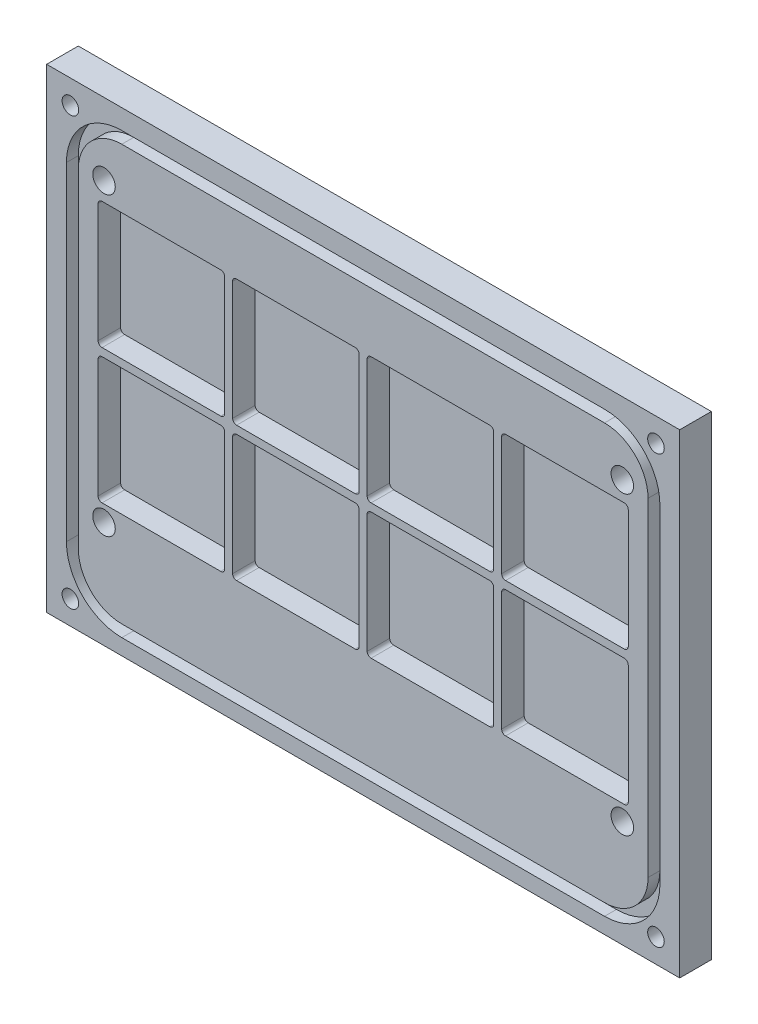
from build123d import *

# Parameters (mm, degrees)
ESQUISSE1_W                                   = 160
ESQUISSE1_H                                   = 120
BOSS_EXTRU_1_DEPTH                            = 8
ESQUISSE2_W                                   = 32
ESQUISSE2_H                                   = 32
ENL_V_MAT_EXTRU_1_DEPTH                       = 5.7
ENL_V_MAT_EXTRU_2_DEPTH                       = 3
TROU_POUR_TARAUDAGE_POUR_TROU_TARAUD_M5_D     = 4.2
TROU_POUR_TARAUDAGE_POUR_TROU_TARAUD_M5_DEPTH = 8
TROU_POUR_TARAUDAGE_POUR_TROU_TARAUD_M5_TIP   = 1.2618073
CONG_1_R                                      = 1
ESQUISSE7_R                                   = 2.845
ENL_V_MAT_EXTRU_3_DEPTH                       = 6


with BuildPart() as part:
    # Esquisse1 → Boss.-Extru.1 (new body)
    with BuildSketch(Plane.XY):
        with Locations((-7.227655867, -5.967741935)):
            Rectangle(ESQUISSE1_W, ESQUISSE1_H)
    extrude(amount=BOSS_EXTRU_1_DEPTH)

    # Esquisse2 → Enlèv. mat.-Extru.1 (cut)
    with BuildSketch(Plane.XY.offset(8)):
        with Locations((-24.227655867, 15.032258065)):
            Rectangle(ESQUISSE2_W, ESQUISSE2_H)
        with Locations((-58.227655867, 15.032258065)):
            Rectangle(ESQUISSE2_W, ESQUISSE2_H)
        with Locations((9.772344133, 15.032258065)):
            Rectangle(ESQUISSE2_W, ESQUISSE2_H)
        with Locations((43.772344133, 15.032258065)):
            Rectangle(ESQUISSE2_W, ESQUISSE2_H)
        with Locations((-24.227655867, -18.967741935)):
            Rectangle(ESQUISSE2_W, ESQUISSE2_H)
        with Locations((9.772344133, -18.967741935)):
            Rectangle(ESQUISSE2_W, ESQUISSE2_H)
        with Locations((43.772344133, -18.967741935)):
            Rectangle(ESQUISSE2_W, ESQUISSE2_H)
        with Locations((-58.227655867, -18.967741935)):
            Rectangle(ESQUISSE2_W, ESQUISSE2_H)
    extrude(amount=-ENL_V_MAT_EXTRU_1_DEPTH, mode=Mode.SUBTRACT)

    # Esquisse3 → Enlèv. mat.-Extru.2 (cut)
    with BuildSketch(Plane.XY.offset(8)):
        with BuildLine():
            Line((-68.227655867, 49.032258065), (53.772344133, 49.032258065))
            ThreePointArc((53.772344133, 49.032258065), (63.67183907, 44.931753001), (67.772344133, 35.032258065))
            Line((67.772344133, 35.032258065), (67.772344133, -47.967741935))
            ThreePointArc((67.772344133, -47.967741935), (63.67183907, -57.867236872), (53.772344133, -61.967741935))
            Line((53.772344133, -61.967741935), (-68.227655867, -61.967741935))
            ThreePointArc((-68.227655867, -61.967741935), (-78.127150803, -57.867236872), (-82.227655867, -47.967741935))
            Line((-82.227655867, -47.967741935), (-82.227655867, 35.032258065))
            ThreePointArc((-82.227655867, 35.032258065), (-78.127150803, 44.931753001), (-68.227655867, 49.032258065))
        make_face()
        with BuildLine():
            Line((-79.227655867, 35.032258065), (-79.227655867, -47.967741935))
            ThreePointArc((-79.227655867, -47.967741935), (-76.00583046, -55.745916529), (-68.227655867, -58.967741935))
            Line((-68.227655867, -58.967741935), (53.772344133, -58.967741935))
            ThreePointArc((53.772344133, -58.967741935), (61.550518726, -55.745916529), (64.772344133, -47.967741935))
            Line((64.772344133, -47.967741935), (64.772344133, 35.032258065))
            ThreePointArc((64.772344133, 35.032258065), (61.550518726, 42.810432658), (53.772344133, 46.032258065))
            Line((53.772344133, 46.032258065), (-68.227655867, 46.032258065))
            ThreePointArc((-68.227655867, 46.032258065), (-76.00583046, 42.810432658), (-79.227655867, 35.032258065))
        make_face(mode=Mode.SUBTRACT)
    extrude(amount=-ENL_V_MAT_EXTRU_2_DEPTH, mode=Mode.SUBTRACT)

    # Trou pour taraudage pour trou taraudé M51
    with Locations(Plane.XY.offset(8)):
        with Locations((-81.227655867, -59.967741935), (-81.227655867, 48.032258065), (66.772344133, 48.032258065), (66.772344133, -59.967741935)):
            Hole(TROU_POUR_TARAUDAGE_POUR_TROU_TARAUD_M5_D / 2, depth=TROU_POUR_TARAUDAGE_POUR_TROU_TARAUD_M5_DEPTH)
            with Locations((0, 0, -(TROU_POUR_TARAUDAGE_POUR_TROU_TARAUD_M5_DEPTH + TROU_POUR_TARAUDAGE_POUR_TROU_TARAUD_M5_TIP / 2))):  # 118° drill point
                Cone(0, TROU_POUR_TARAUDAGE_POUR_TROU_TARAUD_M5_D / 2, TROU_POUR_TARAUDAGE_POUR_TROU_TARAUD_M5_TIP, mode=Mode.SUBTRACT)

    # Congé1
    cong_1_edges = [part.edges().sort_by_distance(p)[0] for p in [
        (-74.227655867, -0.967741935, 5.15),
        (-74.227655867, 31.032258065, 5.15),
        (-42.227655867, 31.032258065, 5.15),
        (-42.227655867, -0.967741935, 5.15),
        (-40.227655867, -0.967741935, 5.15),
        (-40.227655867, 31.032258065, 5.15),
        (-8.227655867, 31.032258065, 5.15),
        (-8.227655867, -0.967741935, 5.15),
        (-6.227655867, -0.967741935, 5.15),
        (-6.227655867, 31.032258065, 5.15),
        (25.772344133, 31.032258065, 5.15),
        (25.772344133, -0.967741935, 5.15),
        (27.772344133, -0.967741935, 5.15),
        (27.772344133, 31.032258065, 5.15),
        (59.772344133, 31.032258065, 5.15),
        (59.772344133, -0.967741935, 5.15),
        (-74.227655867, -34.967741935, 5.15),
        (-74.227655867, -2.967741935, 5.15),
        (-42.227655867, -2.967741935, 5.15),
        (-42.227655867, -34.967741935, 5.15),
        (27.772344133, -34.967741935, 5.15),
        (27.772344133, -2.967741935, 5.15),
        (59.772344133, -2.967741935, 5.15),
        (59.772344133, -34.967741935, 5.15),
        (-6.227655867, -34.967741935, 5.15),
        (-6.227655867, -2.967741935, 5.15),
        (25.772344133, -2.967741935, 5.15),
        (25.772344133, -34.967741935, 5.15),
        (-40.227655867, -34.967741935, 5.15),
        (-40.227655867, -2.967741935, 5.15),
        (-8.227655867, -2.967741935, 5.15),
        (-8.227655867, -34.967741935, 5.15),
    ]]
    fillet(cong_1_edges, radius=CONG_1_R)

    # Esquisse7 → Enlèv. mat.-Extru.3 (cut)
    with BuildSketch(Plane.XY.offset(8)):
        with Locations((-72.727655867, 35.832258065)):
            Circle(ESQUISSE7_R)
        with Locations((-72.727655867, -38.967741935)):
            Circle(ESQUISSE7_R)
        with Locations((58.272344133, -38.967741935)):
            Circle(ESQUISSE7_R)
        with Locations((58.272344133, 35.832258065)):
            Circle(ESQUISSE7_R)
    extrude(amount=-ENL_V_MAT_EXTRU_3_DEPTH, mode=Mode.SUBTRACT)


solid = part.part
